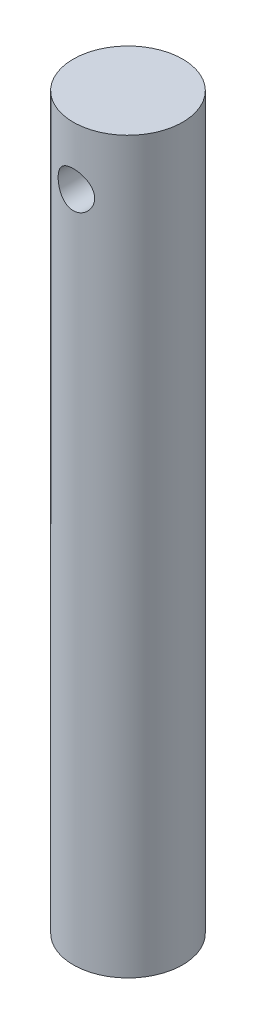
from build123d import *

# Parameters (mm, degrees)
SKETCH2_W               = 4.75996
SKETCH2_H               = 63.5
CUT_EXTRUDE1_DEPTH      = 64.855809747
CUT_EXTRUDE1_DEPTH_BACK = 64.855809747
SKETCH3_R               = 1.5875


with BuildPart() as part:
    # Sketch2 → Revolve1 (revolve)
    with BuildSketch(Plane.XY, mode=Mode.PRIVATE) as revolve1_sk:
        with Locations((2.37998, -31.75)):
            Rectangle(SKETCH2_W, SKETCH2_H)
    revolve(revolve1_sk.sketch.rotate(Axis((0, 0, 0), (0, -1, 0)), 180), axis=Axis((0, 0, 0), (0, -1, 0)))

    # Sketch3 → Cut-Extrude1 (cut, two sides: drawn at the far end of the back side and taken through both)
    with BuildSketch(Plane.XY.offset(-CUT_EXTRUDE1_DEPTH_BACK)):
        with Locations((0, -5.08)):
            Circle(SKETCH3_R)
    extrude(amount=CUT_EXTRUDE1_DEPTH + CUT_EXTRUDE1_DEPTH_BACK, mode=Mode.SUBTRACT)


solid = part.part
